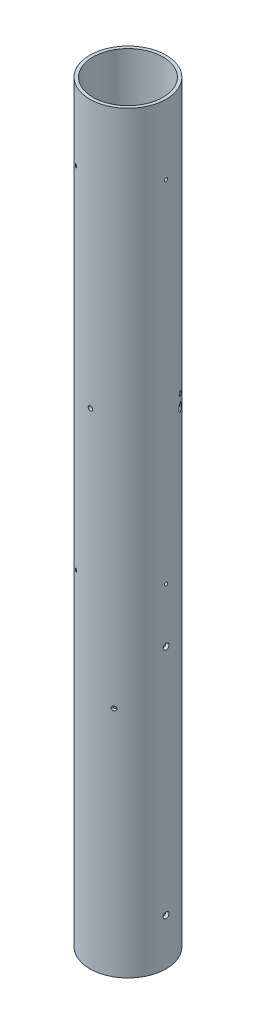
from build123d import *

# Parameters (mm, degrees)
SKETCH1_R                             = 41.656
SKETCH1_R_2                           = 38.227
BOSS_EXTRUDE1_DEPTH                   = 822.5282
S1A_COUPLER_REACH                     = 830.552
SKETCH2_R                             = 1.778
S1A_COUPLER_PATTERN_COUNT             = 3
S1A_RAIL_GUIDE_REACH                  = 829.785
SKETCH3_R                             = 3.175
S1A_PRESSURE_REACH                    = 830.541
SKETCH4_R                             = 2.38125
S1A_PRESSURE_PATTERN_COUNT            = 3
SWITCH_SLOT_REACH                     = 830.563
S1A_PRESSURE_2_REACH                  = 830.552
SKETCH7_R                             = 2.38125
S1A_PRESSURE_2_PATTERN_COUNT          = 3
S1B_PROPULSION_BULKHEAD_REACH         = 830.552
SKETCH8_R                             = 1.7859375
S1B_PROPULSION_BULKHEAD_PATTERN_COUNT = 3


with BuildPart() as part:
    # Sketch1 → Boss-Extrude1 (new body)
    with BuildSketch(Plane(origin=(0, 0, 0), x_dir=(1, 0, 0), z_dir=(0, 1, 0))):
        Circle(SKETCH1_R)
        Circle(SKETCH1_R_2, mode=Mode.SUBTRACT)
    extrude(amount=BOSS_EXTRUDE1_DEPTH)

    # Sketch2 → S1A_Coupler (cut, up to next)
    with BuildSketch(Plane(origin=(-20.828, 0, 36.07515422), x_dir=(0, -1, 0), z_dir=(-0.499999999999998, 0, 0.8660254037844398)), mode=Mode.PRIVATE) as s1a_coupler_sk1:
        with Locations((-746.3282, 0)):
            Circle(SKETCH2_R)
    s1a_coupler_tool1 = extrude(s1a_coupler_sk1.sketch, amount=-S1A_COUPLER_REACH, mode=Mode.PRIVATE) & part.part
    s1a_coupler = s1a_coupler_tool1.solids().sort_by_distance((-20.828, 746.3282, 36.075154))[0]
    add(s1a_coupler, mode=Mode.SUBTRACT)

    # S1A_Coupler_Pattern: S1A_Coupler ×3 about axis
    s1a_coupler_pattern_axis = Axis((0, -40.64, 0), (0, 1, 0))
    for i in range(1, S1A_COUPLER_PATTERN_COUNT):
        add(s1a_coupler.rotate(s1a_coupler_pattern_axis, i * 360 / S1A_COUPLER_PATTERN_COUNT), mode=Mode.SUBTRACT)

    # Sketch3 → S1A_Rail_Guide (cut, up to next)
    with BuildSketch(Plane(origin=(41.656, 0, 0), x_dir=(0, 0, -1), z_dir=(1, 0, 0)), mode=Mode.PRIVATE) as s1a_rail_guide_sk1:
        with Locations((0, 50.8)):
            Circle(SKETCH3_R)
    s1a_rail_guide_tool1 = extrude(s1a_rail_guide_sk1.sketch, amount=-S1A_RAIL_GUIDE_REACH, mode=Mode.PRIVATE) & part.part
    # Sketch3 → S1A_Rail_Guide (cut, up to next)
    with BuildSketch(Plane(origin=(41.656, 0, 0), x_dir=(0, 0, -1), z_dir=(1, 0, 0)), mode=Mode.PRIVATE) as s1a_rail_guide_sk2:
        with Locations((0, 304.8)):
            Circle(SKETCH3_R)
    s1a_rail_guide_tool2 = extrude(s1a_rail_guide_sk2.sketch, amount=-S1A_RAIL_GUIDE_REACH, mode=Mode.PRIVATE) & part.part
    add(s1a_rail_guide_tool1.solids().sort_by_distance((41.656, 50.8, 0))[0], mode=Mode.SUBTRACT)
    add(s1a_rail_guide_tool2.solids().sort_by_distance((41.656, 304.8, 0))[0], mode=Mode.SUBTRACT)

    # Sketch4 → S1A_Pressure (cut, up to next)
    with BuildSketch(Plane(origin=(-36.365988404, 0, -20.315935208), x_dir=(0, -1, 0), z_dir=(-0.8730072115474079, 0, -0.48770729806536567)), mode=Mode.PRIVATE) as s1a_pressure_sk1:
        with Locations((-530.4282, 0)):
            Circle(SKETCH4_R)
    s1a_pressure_tool1 = extrude(s1a_pressure_sk1.sketch, amount=-S1A_PRESSURE_REACH, mode=Mode.PRIVATE) & part.part
    s1a_pressure = s1a_pressure_tool1.solids().sort_by_distance((-36.365988, 530.4282, -20.315935))[0]
    add(s1a_pressure, mode=Mode.SUBTRACT)

    # S1A_Pressure_Pattern: S1A_Pressure ×3 about axis
    s1a_pressure_pattern_axis = Axis((0, -40.64, 0), (0, 1, 0))
    for i in range(1, S1A_PRESSURE_PATTERN_COUNT):
        add(s1a_pressure.rotate(s1a_pressure_pattern_axis, i * 360 / S1A_PRESSURE_PATTERN_COUNT), mode=Mode.SUBTRACT)

    # Sketch6 → Switch_Slot (cut, up to next)
    with BuildSketch(Plane(origin=(35.777110194, 0, -21.335902188), x_dir=(0, -1, 0), z_dir=(0.8588705155093787, 0, -0.5121927738543899)), mode=Mode.PRIVATE) as switch_slot_sk1:
        with BuildLine():
            Line((-518.9982, 3.175), (-516.4582, 3.175))
            ThreePointArc((-516.4582, 3.175), (-513.2832, 0), (-516.4582, -3.175))
            Line((-516.4582, -3.175), (-518.9982, -3.175))
            ThreePointArc((-518.9982, -3.175), (-522.1732, 0), (-518.9982, 3.175))
        make_face()
    switch_slot_tool1 = extrude(switch_slot_sk1.sketch, amount=-SWITCH_SLOT_REACH, mode=Mode.PRIVATE) & part.part
    add(switch_slot_tool1.solids().sort_by_distance((35.77711, 517.7282, -21.335902))[0], mode=Mode.SUBTRACT)

    # Sketch7 → S1A_Pressure_2 (cut, up to next)
    with BuildSketch(Plane(origin=(20.828, 0, 36.07515422), x_dir=(0, -1, 0), z_dir=(0.499999999999998, 0, 0.8660254037844398)), mode=Mode.PRIVATE) as s1a_pressure_2_sk1:
        with Locations((-254, 0)):
            Circle(SKETCH7_R)
    s1a_pressure_2_tool1 = extrude(s1a_pressure_2_sk1.sketch, amount=-S1A_PRESSURE_2_REACH, mode=Mode.PRIVATE) & part.part
    s1a_pressure_2 = s1a_pressure_2_tool1.solids().sort_by_distance((20.828, 254, 36.075154))[0]
    add(s1a_pressure_2, mode=Mode.SUBTRACT)

    # S1A_Pressure_2_Pattern: S1A_Pressure_2 ×3 about axis
    s1a_pressure_2_pattern_axis = Axis((0, -40.64, 0), (0, 1, 0))
    for i in range(1, S1A_PRESSURE_2_PATTERN_COUNT):
        add(s1a_pressure_2.rotate(s1a_pressure_2_pattern_axis, i * 360 / S1A_PRESSURE_2_PATTERN_COUNT), mode=Mode.SUBTRACT)

    # Sketch8 → S1B_Propulsion_Bulkhead (cut, up to next)
    with BuildSketch(Plane(origin=(-20.828, 0, 36.07515422), x_dir=(0, -1, 0), z_dir=(-0.499999999999998, 0, 0.8660254037844398)), mode=Mode.PRIVATE) as s1b_propulsion_bulkhead_sk1:
        with Locations((-364.1217, 0)):
            Circle(SKETCH8_R)
    s1b_propulsion_bulkhead_tool1 = extrude(s1b_propulsion_bulkhead_sk1.sketch, amount=-S1B_PROPULSION_BULKHEAD_REACH, mode=Mode.PRIVATE) & part.part
    s1b_propulsion_bulkhead = s1b_propulsion_bulkhead_tool1.solids().sort_by_distance((-20.828, 364.1217, 36.075154))[0]
    add(s1b_propulsion_bulkhead, mode=Mode.SUBTRACT)

    # S1B_Propulsion_Bulkhead_Pattern: S1B_Propulsion_Bulkhead ×3 about axis
    s1b_propulsion_bulkhead_pattern_axis = Axis((0, -40.64, 0), (0, 1, 0))
    for i in range(1, S1B_PROPULSION_BULKHEAD_PATTERN_COUNT):
        add(s1b_propulsion_bulkhead.rotate(s1b_propulsion_bulkhead_pattern_axis, i * 360 / S1B_PROPULSION_BULKHEAD_PATTERN_COUNT), mode=Mode.SUBTRACT)


solid = part.part
